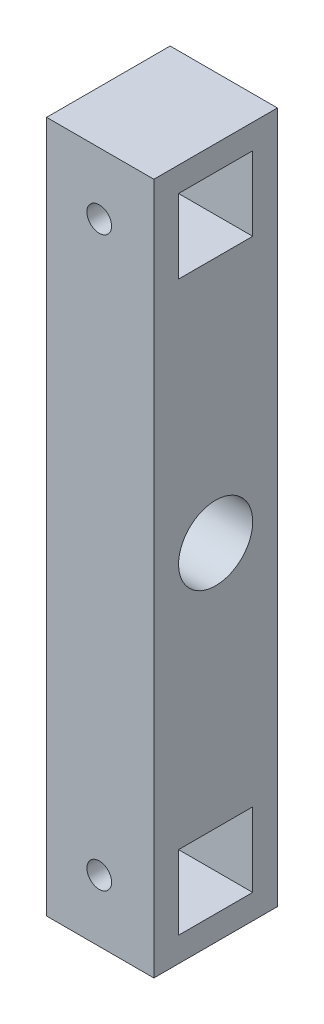
from build123d import *

# Parameters (mm, degrees)
SKETCH1_W           = 43.412860342
SKETCH1_H           = 140
BOSS_EXTRUDE1_DEPTH = 50
SKETCH2_R           = 5
CUT_EXTRUDE1_DEPTH  = 50
SKETCH3_W           = 30
SKETCH3_H           = 30
CUT_EXTRUDE2_DEPTH  = 50
SKETCH5_R           = 15
CUT_EXTRUDE3_DEPTH  = 50


with BuildPart() as part:
    # Sketch1 → Boss-Extrude1 (new body)
    with BuildSketch(Plane.XY):
        with Locations((230.409564966, -45)):
            Rectangle(SKETCH1_W, SKETCH1_H)
        with Locations((230.409564966, -185)):
            Rectangle(SKETCH1_W, SKETCH1_H)
    extrude(amount=BOSS_EXTRUDE1_DEPTH)

    # Sketch2 → Cut-Extrude1 (cut)
    with BuildSketch(Plane.XY.offset(50)):
        with Locations((230, 0)):
            Circle(SKETCH2_R)
        with Locations((230, -230)):
            Circle(SKETCH2_R)
    extrude(amount=-CUT_EXTRUDE1_DEPTH, mode=Mode.SUBTRACT)

    # Sketch3 → Cut-Extrude2 (cut)
    with BuildSketch(Plane(origin=(252.115995137, 0, 0), x_dir=(0, 0, -1), z_dir=(1, 0, 0))):
        with Locations((-25, 0)):
            Rectangle(SKETCH3_W, SKETCH3_H)
        with Locations((-25, -230)):
            Rectangle(SKETCH3_W, SKETCH3_H)
    extrude(amount=-CUT_EXTRUDE2_DEPTH, mode=Mode.SUBTRACT)

    # Sketch5 → Cut-Extrude3 (cut)
    with BuildSketch(Plane(origin=(252.115995137, 0, 0), x_dir=(0, 0, -1), z_dir=(1, 0, 0))):
        with Locations(Location((-25, -115, 0), (0, 0, 90))):
            Circle(SKETCH5_R)
    extrude(amount=-CUT_EXTRUDE3_DEPTH, mode=Mode.SUBTRACT)


solid = part.part
